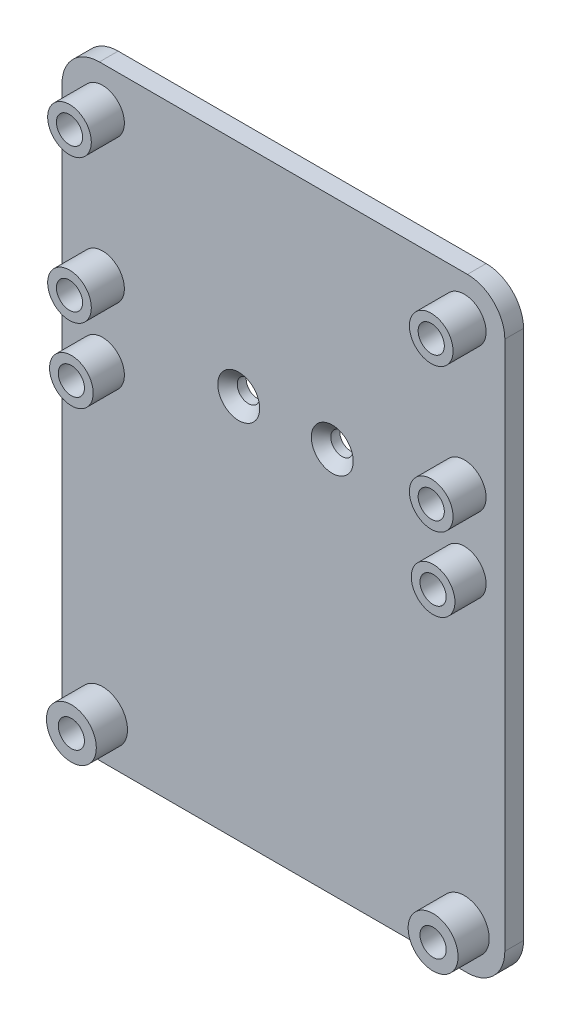
from build123d import *

# Parameters (mm, degrees)
SKETCH1_R                                            = 1.375
BOSS_EXTRUDE1_DEPTH                                  = 3
SKETCH2_R                                            = 4
SKETCH2_R_2                                          = 1.375
SKETCH2_R_3                                          = 3.5
BOSS_EXTRUDE2_DEPTH                                  = 5
SKETCH2_3_R                                          = 3.5
SKETCH2_3_R_2                                        = 1.375
BOSS_EXTRUDE3_DEPTH                                  = 5.3
SKETCH3_R                                            = 2.1
CUT_EXTRUDE1_DEPTH                                   = 102.373468088
CSK_FOR_M3_HEX_SOCKET_COUNTERSUNK_CAP_SC_D           = 3.6
CSK_FOR_M3_HEX_SOCKET_COUNTERSUNK_CAP_SC_DEPTH       = 14.44
CSK_FOR_M3_HEX_SOCKET_COUNTERSUNK_CAP_SC_CSINK_D     = 6.72
CSK_FOR_M3_HEX_SOCKET_COUNTERSUNK_CAP_SC_CSINK_ANGLE = 90
CSK_FOR_M3_HEX_SOCKET_COUNTERSUNK_CAP_SC_TIP         = 1.081549114
SKETCH6_W                                            = 40.311227037
SKETCH6_H                                            = 68
CUT_EXTRUDE2_DEPTH                                   = 102.172031867
FILLET1_R                                            = 6


with BuildPart() as part:
    # Sketch1 → Boss-Extrude1 (new body)
    with BuildSketch(Plane.XY):
        with BuildLine():
            ThreePointArc((-78.424167346, 6.5), (-82.666808033, 4.742640687), (-84.424167346, 0.5))
            Line((-84.424167346, 0.5), (-84.424167346, -49.5))
            ThreePointArc((-84.424167346, -49.5), (-82.666808033, -53.742640687), (-78.424167346, -55.5))
            Line((-78.424167346, -55.5), (0.5, -55.5))
            ThreePointArc((0.5, -55.5), (4.742640687, -53.742640687), (6.5, -49.5))
            Line((6.5, -49.5), (6.5, 35.5))
            ThreePointArc((6.5, 35.5), (4.742640687, 39.742640687), (0.5, 41.5))
            Line((0.5, 41.5), (-58.5, 41.5))
            ThreePointArc((-58.5, 41.5), (-62.742640687, 39.742640687), (-64.5, 35.5))
            Line((-64.5, 35.5), (-64.5, 12.5))
            ThreePointArc((-64.5, 12.5), (-66.257359313, 8.257359313), (-70.5, 6.5))
            Line((-70.5, 6.5), (-78.424167346, 6.5))
        make_face()
        with Locations((-58, -49)):
            Circle(SKETCH1_R, mode=Mode.SUBTRACT)
        with Locations((0, -49)):
            Circle(SKETCH1_R, mode=Mode.SUBTRACT)
        with Locations((-58, 0)):
            Circle(SKETCH1_R, mode=Mode.SUBTRACT)
        Circle(SKETCH1_R, mode=Mode.SUBTRACT)
        with Locations((-58, 12)):
            Circle(SKETCH1_R, mode=Mode.SUBTRACT)
        with Locations((-58, 35)):
            Circle(SKETCH1_R, mode=Mode.SUBTRACT)
        with Locations((0, 12)):
            Circle(SKETCH1_R, mode=Mode.SUBTRACT)
        with Locations((0, 35)):
            Circle(SKETCH1_R, mode=Mode.SUBTRACT)
    extrude(amount=BOSS_EXTRUDE1_DEPTH)

    # Sketch2 → Boss-Extrude2 (add)
    # profile 1 of 4: a face of its own
    with BuildSketch(Plane.XY.offset(3)):
        with Locations((-58, -49)):
            Circle(SKETCH2_R)
        with Locations((-58, -49)):
            Circle(SKETCH2_R_2, mode=Mode.SUBTRACT)
    # profile 2 of 4: a face of its own
    with BuildSketch(Plane.XY.offset(3)):
        with Locations((0, -49)):
            Circle(SKETCH2_R)
        with Locations((0, -49)):
            Circle(SKETCH2_R_2, mode=Mode.SUBTRACT)
    # profile 3 of 4: a face of its own
    with BuildSketch(Plane.XY.offset(3)):
        Circle(SKETCH2_R_3)
        Circle(SKETCH2_R_2, mode=Mode.SUBTRACT)
    # profile 4 of 4: a face of its own
    with BuildSketch(Plane.XY.offset(3)):
        with Locations((-58, 0)):
            Circle(SKETCH2_R_3)
        with Locations((-58, 0)):
            Circle(SKETCH2_R_2, mode=Mode.SUBTRACT)
    extrude(amount=BOSS_EXTRUDE2_DEPTH)

    # Sketch2<3> → Boss-Extrude3 (add)
    # profile 1 of 4: a face of its own
    with BuildSketch(Plane.XY.offset(3)):
        with Locations((-58, 35)):
            Circle(SKETCH2_3_R)
        with Locations((-58, 35)):
            Circle(SKETCH2_3_R_2, mode=Mode.SUBTRACT)
    # profile 2 of 4: a face of its own
    with BuildSketch(Plane.XY.offset(3)):
        with Locations((-58, 12)):
            Circle(SKETCH2_3_R)
        with Locations((-58, 12)):
            Circle(SKETCH2_3_R_2, mode=Mode.SUBTRACT)
    # profile 3 of 4: a face of its own
    with BuildSketch(Plane.XY.offset(3)):
        with Locations((0, 35)):
            Circle(SKETCH2_3_R)
        with Locations((0, 35)):
            Circle(SKETCH2_3_R_2, mode=Mode.SUBTRACT)
    # profile 4 of 4: a face of its own
    with BuildSketch(Plane.XY.offset(3)):
        with Locations((0, 12)):
            Circle(SKETCH2_3_R)
        with Locations((0, 12)):
            Circle(SKETCH2_3_R_2, mode=Mode.SUBTRACT)
    extrude(amount=BOSS_EXTRUDE3_DEPTH)

    # Sketch3 → Cut-Extrude1 (cut, through all)
    with BuildSketch(Plane.XY.offset(8.3)):
        with Locations((-58, 35)):
            Circle(SKETCH3_R)
        with Locations((0, 35)):
            Circle(SKETCH3_R)
        with Locations((0, 12)):
            Circle(SKETCH3_R)
        with Locations((-58, 12)):
            Circle(SKETCH3_R)
        with Locations((-58, 0)):
            Circle(SKETCH3_R)
        Circle(SKETCH3_R)
        with Locations((-58, -49)):
            Circle(SKETCH3_R)
        with Locations((0, -49)):
            Circle(SKETCH3_R)
    extrude(amount=-CUT_EXTRUDE1_DEPTH, mode=Mode.SUBTRACT)

    # CSK for M3 Hex Socket Countersunk Cap Screw1
    with Locations(Plane.XY.offset(3)):
        with Locations((-36.16376606, 6.225895505), (-21.164712778, 6.394420408)):
            CounterSinkHole(CSK_FOR_M3_HEX_SOCKET_COUNTERSUNK_CAP_SC_D / 2, CSK_FOR_M3_HEX_SOCKET_COUNTERSUNK_CAP_SC_CSINK_D / 2, depth=CSK_FOR_M3_HEX_SOCKET_COUNTERSUNK_CAP_SC_DEPTH, counter_sink_angle=CSK_FOR_M3_HEX_SOCKET_COUNTERSUNK_CAP_SC_CSINK_ANGLE)
            with Locations((0, 0, -(CSK_FOR_M3_HEX_SOCKET_COUNTERSUNK_CAP_SC_DEPTH + CSK_FOR_M3_HEX_SOCKET_COUNTERSUNK_CAP_SC_TIP / 2))):  # 118° drill point
                Cone(0, CSK_FOR_M3_HEX_SOCKET_COUNTERSUNK_CAP_SC_D / 2, CSK_FOR_M3_HEX_SOCKET_COUNTERSUNK_CAP_SC_TIP, mode=Mode.SUBTRACT)

    # Sketch6 → Cut-Extrude2 (cut, through all)
    with BuildSketch(Plane.XY.offset(3)):
        with Locations((-84.655613519, -21.5)):
            Rectangle(SKETCH6_W, SKETCH6_H)
    extrude(amount=-CUT_EXTRUDE2_DEPTH, mode=Mode.SUBTRACT)

    # Fillet1
    fillet1_edges = [part.edges().sort_by_distance(p)[0] for p in [
        (-64.5, -55.5, 1.5),
    ]]
    fillet(fillet1_edges, radius=FILLET1_R)


solid = part.part
